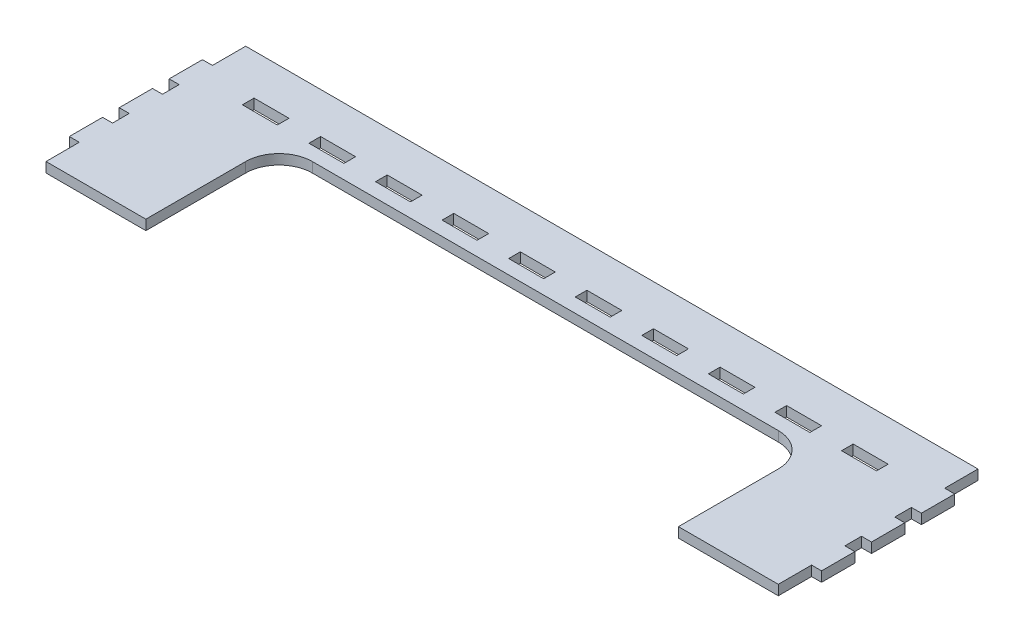
from build123d import *

# Parameters (mm, degrees)
EXTRUDE_1_DEPTH     = 3
SKETCH_2_W          = 10.5
SKETCH_2_H          = 3.5
CUT_EXTRUDE_1_DEPTH = 150.258104234


with BuildPart() as part:
    # Эскиз1 → Бобышка-Вытянуть1 (new body)
    with BuildSketch(Plane(origin=(0, 0, 0), x_dir=(1, 0, 0), z_dir=(0, 1, 0))):
        with BuildLine():
            Line((-135, -31.788922156), (-138, -31.788922156))
            Line((-138, -31.788922156), (-138, -21.788922156))
            Line((-138, -21.788922156), (-135, -21.788922156))
            Line((-135, -21.788922156), (-135, -16.788922156))
            Line((-135, -16.788922156), (-138, -16.788922156))
            Line((-138, -16.788922156), (-138, -6.788922156))
            Line((-138, -6.788922156), (-135, -6.788922156))
            Line((-135, -6.788922156), (-135, 3.211077844))
            Line((-135, 3.211077844), (-125, 3.211077844))
            Line((-125, 3.211077844), (75, 3.211077844))
            Line((75, 3.211077844), (85, 3.211077844))
            Line((85, 3.211077844), (85, -6.788922156))
            Line((85, -6.788922156), (88, -6.788922156))
            Line((88, -6.788922156), (88, -16.788922156))
            Line((88, -16.788922156), (85, -16.788922156))
            Line((85, -16.788922156), (85, -21.788922156))
            Line((85, -21.788922156), (88, -21.788922156))
            Line((88, -21.788922156), (88, -31.788922156))
            Line((88, -31.788922156), (85, -31.788922156))
            Line((85, -31.788922156), (85, -36.788922156))
            Line((85, -36.788922156), (88, -36.788922156))
            Line((88, -36.788922156), (88, -46.788922156))
            Line((88, -46.788922156), (85, -46.788922156))
            Line((85, -46.788922156), (85, -56.788922156))
            Line((85, -56.788922156), (55, -56.788922156))
            Line((55, -56.788922156), (55, -26.788922156))
            ThreePointArc((55, -26.788922156), (52.071067812, -19.717854344), (45, -16.788922156))
            Line((45, -16.788922156), (-95, -16.788922156))
            ThreePointArc((-95, -16.788922156), (-102.071067812, -19.717854344), (-105, -26.788922156))
            Line((-105, -26.788922156), (-105, -56.788922156))
            Line((-105, -56.788922156), (-135, -56.788922156))
            Line((-135, -56.788922156), (-135, -46.788922156))
            Line((-135, -46.788922156), (-138, -46.788922156))
            Line((-138, -46.788922156), (-138, -36.788922156))
            Line((-138, -36.788922156), (-135, -36.788922156))
            Line((-135, -36.788922156), (-135, -31.788922156))
        make_face()
    extrude(amount=EXTRUDE_1_DEPTH)

    # Эскиз2 → Вырез-Вытянуть1 (cut, through all)
    with BuildSketch(Plane(origin=(0, 0, 0), x_dir=(1, 0, 0), z_dir=(0, 1, 0))):
        with Locations((-115, -10.788922156)):
            Rectangle(SKETCH_2_W, SKETCH_2_H)
        with Locations((-95, -10.788922156)):
            Rectangle(SKETCH_2_W, SKETCH_2_H)
        with Locations((-75, -10.788922156)):
            Rectangle(SKETCH_2_W, SKETCH_2_H)
        with Locations((-55, -10.788922156)):
            Rectangle(SKETCH_2_W, SKETCH_2_H)
        with Locations((-35, -10.788922156)):
            Rectangle(SKETCH_2_W, SKETCH_2_H)
        with Locations((-15, -10.788922156)):
            Rectangle(SKETCH_2_W, SKETCH_2_H)
        with Locations((5, -10.788922156)):
            Rectangle(SKETCH_2_W, SKETCH_2_H)
        with Locations((25, -10.788922156)):
            Rectangle(SKETCH_2_W, SKETCH_2_H)
        with Locations((45, -10.788922156)):
            Rectangle(SKETCH_2_W, SKETCH_2_H)
        with Locations((65, -10.788922156)):
            Rectangle(SKETCH_2_W, SKETCH_2_H)
    extrude(amount=CUT_EXTRUDE_1_DEPTH, mode=Mode.SUBTRACT)


solid = part.part
